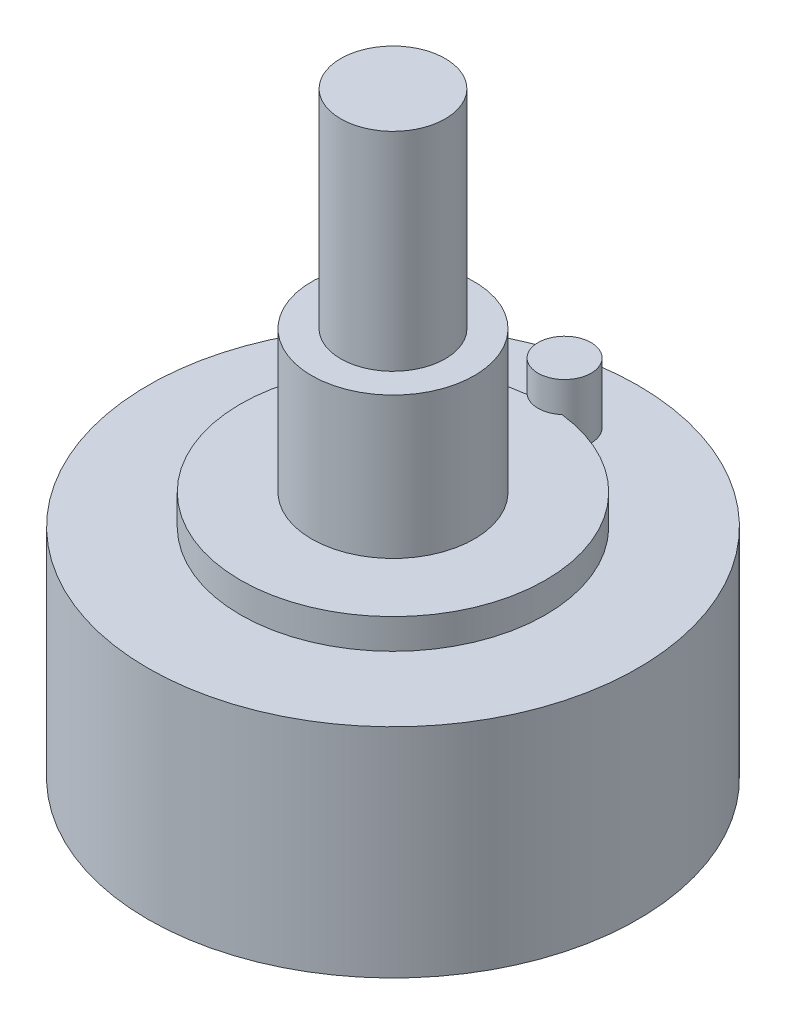
from build123d import *

# Parameters (mm, degrees)
SKETCH1_R           = 13.85
BOSS_EXTRUDE1_DEPTH = 12.3
SKETCH2_R           = 8.625
BOSS_EXTRUDE2_DEPTH = 1.7
SKETCH3_R           = 4.6
BOSS_EXTRUDE3_DEPTH = 8
SKETCH4_R           = 2.955
BOSS_EXTRUDE4_DEPTH = 11.75
SKETCH5_R           = 1.5
BOSS_EXTRUDE5_DEPTH = 3.42


with BuildPart() as part:
    # Sketch1 → Boss-Extrude1 (new body)
    with BuildSketch(Plane(origin=(0, 0, 0), x_dir=(1, 0, 0), z_dir=(0, 1, 0))):
        with Locations(Location((0, 0, 0), (0, 0, 270))):
            Circle(SKETCH1_R)
    extrude(amount=BOSS_EXTRUDE1_DEPTH)

    # Sketch2 → Boss-Extrude2 (add)
    with BuildSketch(Plane(origin=(0, 12.3, 0), x_dir=(1, 0, 0), z_dir=(0, 1, 0))):
        with Locations(Location((0, 0, 0), (0, 0, 270))):
            Circle(SKETCH2_R)
    extrude(amount=BOSS_EXTRUDE2_DEPTH)

    # Sketch3 → Boss-Extrude3 (add)
    with BuildSketch(Plane(origin=(0, 14, 0), x_dir=(1, 0, 0), z_dir=(0, 1, 0))):
        with Locations(Location((0, 0, 0), (0, 0, 270))):
            Circle(SKETCH3_R)
    extrude(amount=BOSS_EXTRUDE3_DEPTH)

    # Sketch4 → Boss-Extrude4 (add)
    with BuildSketch(Plane(origin=(0, 22, 0), x_dir=(1, 0, 0), z_dir=(0, 1, 0))):
        with Locations(Location((0, 0, 0), (0, 0, 270))):
            Circle(SKETCH4_R)
    extrude(amount=BOSS_EXTRUDE4_DEPTH)

    # Sketch5 → Boss-Extrude5 (add)
    with BuildSketch(Plane(origin=(0, 12.3, 0), x_dir=(1, 0, 0), z_dir=(0, 1, 0))):
        with Locations(Location((0, 9.7, 0), (0, 0, 228.961978667))):
            Circle(SKETCH5_R)
    extrude(amount=BOSS_EXTRUDE5_DEPTH)


solid = part.part
